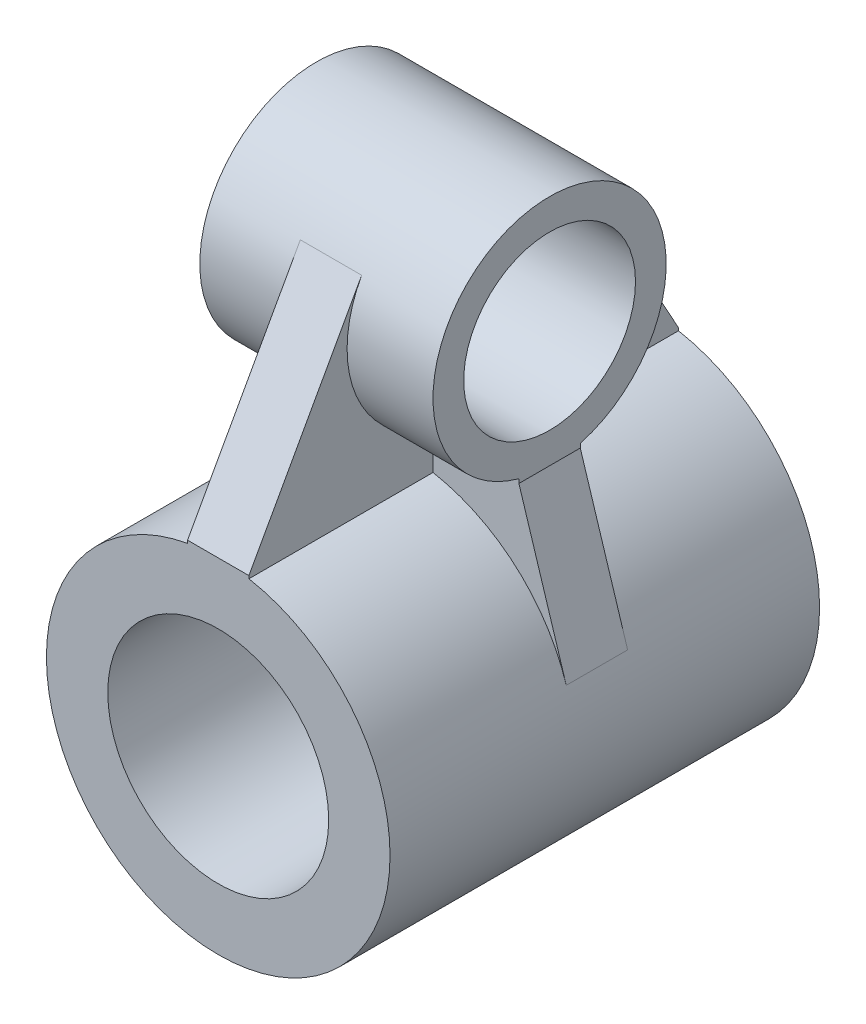
from build123d import *

# Parameters (mm, degrees)
SKETCH1_R           = 14
SKETCH1_R_2         = 9
BOSS_EXTRUDE1_DEPTH = 17.5
SKETCH5_R           = 9.5
SKETCH5_R_2         = 7
BOSS_EXTRUDE2_DEPTH = 9.5
BOSS_EXTRUDE3_DEPTH = 2.5
SKETCH7_W           = 5
SKETCH7_H           = 17.5
BOSS_EXTRUDE4_DEPTH = 0.225023
BOSS_EXTRUDE5_DEPTH = 2.5
BOSS_EXTRUDE9_DEPTH = 2.5


with BuildPart() as part:
    # Sketch1 → Boss-Extrude1 (new, symmetric)
    with BuildSketch(Plane.XY):
        Circle(SKETCH1_R)
        Circle(SKETCH1_R_2, mode=Mode.SUBTRACT)
    extrude(amount=BOSS_EXTRUDE1_DEPTH, both=True)



with BuildPart() as body_2:
    # Sketch5 → Boss-Extrude2 (new, symmetric)
    with BuildSketch(Plane(origin=(0, 0, 0), x_dir=(0, 0, -1), z_dir=(1, 0, 0))):
        with Locations((0, 26)):
            Circle(SKETCH5_R)
        with Locations((0, 26)):
            Circle(SKETCH5_R_2, mode=Mode.SUBTRACT)
    extrude(amount=BOSS_EXTRUDE2_DEPTH, both=True)

    # Sketch6 → Boss-Extrude3 (add, symmetric)
    with BuildSketch(Plane(origin=(0, 0, 0), x_dir=(0, 0, -1), z_dir=(1, 0, 0))):
        with BuildLine():
            Line((-8.311766618, 30.600492984), (-17.5, 14))
            Line((-17.5, 14), (0, 14))
            Line((0, 14), (0, 16.5))
            ThreePointArc((0, 16.5), (-8.183968577, 21.175825633), (-8.311766618, 30.600492984))
        make_face()
    extrude(amount=BOSS_EXTRUDE3_DEPTH, both=True)


with BuildPart() as part_1:
    add(part.part)

    add(body_2.part)  # Boss-Extrude4 merges body 2
    # Sketch7 → Boss-Extrude4 (add)
    with BuildSketch(Plane.XZ.offset(-14)):
        with Locations((0, 8.75)):
            Rectangle(SKETCH7_W, SKETCH7_H)
    extrude(amount=BOSS_EXTRUDE4_DEPTH)

    # Sketch8 → Boss-Extrude5 (add, symmetric)
    with BuildSketch(Plane(origin=(0, 0, 0), x_dir=(0, 0, -1), z_dir=(1, 0, 0))):
        with BuildLine():
            Line((17.5, 14), (8.311766618, 30.600492984))
            ThreePointArc((8.311766618, 30.600492984), (9.198146087, 28.375733269), (9.5, 26))
            ThreePointArc((9.5, 26), (6.717514421, 19.282485579), (0, 16.5))
            Line((0, 16.5), (0, 14))
            Line((0, 14), (0, 13.650311759))
            Line((0, 13.650311759), (17.5, 13.650311759))
            Line((17.5, 13.650311759), (17.5, 14))
        make_face()
    extrude(amount=BOSS_EXTRUDE5_DEPTH, both=True)

    # Sketch9 → Boss-Extrude9 (add, symmetric)
    with BuildSketch(Plane.XY):
        with BuildLine():
            ThreePointArc((-13.359188152, 4.187134094), (-8.28794675, 11.283170594), (0, 14))
            Line((0, 14), (0, 16.5))
            Line((0, 16.5), (0, 17.5))
            Line((0, 17.5), (-9.5, 17.5))
            Line((-9.5, 17.5), (-9.5, 16.5))
            Line((-9.5, 16.5), (-13.359188152, 4.187134094))
        make_face()
    boss_extrude9 = extrude(amount=BOSS_EXTRUDE9_DEPTH, both=True)

    # Mirror9: Boss-Extrude9 across plane
    add(boss_extrude9.mirror(Plane(origin=(0, 0, 0), x_dir=(0, 0, 1), z_dir=(1, 0, 0))))


solid = part_1.part
